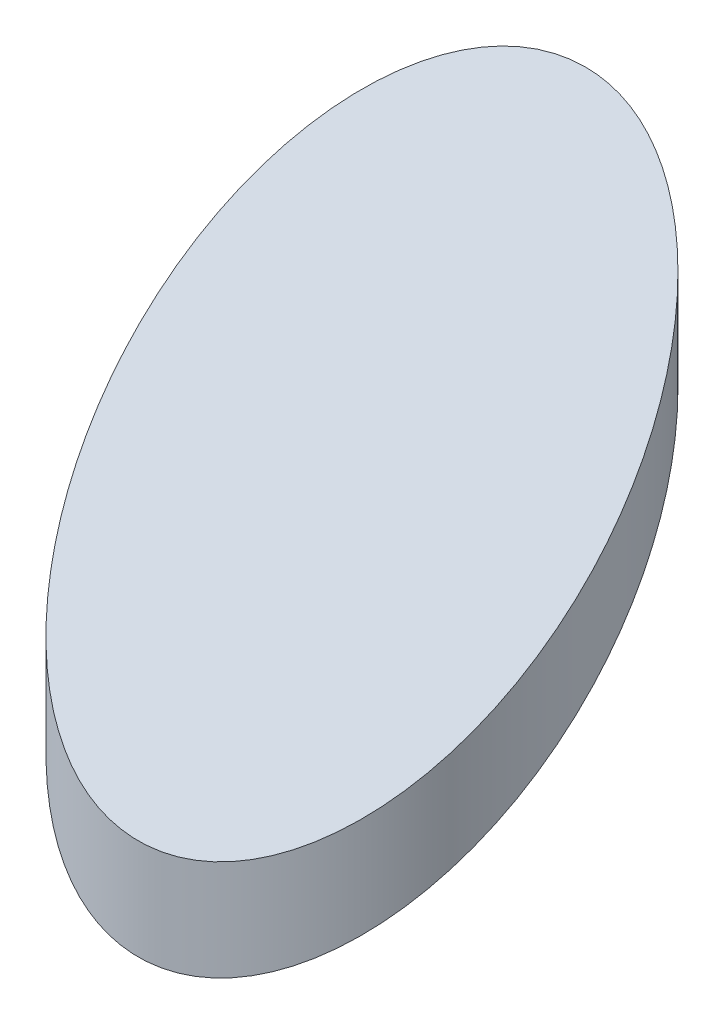
from build123d import *

# Parameters (mm, degrees)
SKETCH2_R               = 20
BOSS_EXTRUDE1_DEPTH     = 2
CUT_EXTRUDE2_DEPTH      = 46.628938186
CUT_EXTRUDE2_DEPTH_BACK = 46.628938186
SKETCH6_R               = 25.059608459
SKETCH6_R_2             = 6.28
SKETCH3_R               = 7.4
SKETCH3_R_2             = 5.9
BOSS_EXTRUDE2_DEPTH     = 1
SKETCH7_R               = 13.022061682
CUT_EXTRUDE3_DEPTH      = 1


with BuildPart() as part:
    # Sketch2 → Boss-Extrude1 (new body)
    with BuildSketch(Plane(origin=(0, 0, 0), x_dir=(1, 0, 0), z_dir=(0, 0.7071067811865464, 0.7071067811865488))):
        with Locations(Location((0, 20, 0), (0, 0, 270))):
            Circle(SKETCH2_R)
    extrude(amount=-BOSS_EXTRUDE1_DEPTH)

    # Sketch6 → Cut-Extrude2 (cut, two sides: drawn at the far end of the back side and taken through both)
    with BuildSketch(Plane(origin=(0, 0, 0), x_dir=(1, 0, 0), z_dir=(0, 1, 0)).offset(-CUT_EXTRUDE2_DEPTH_BACK)):
        with Locations((0, 9)):
            Circle(SKETCH6_R)
        with Locations(Location((0, 9, 0), (0, 0, 90))):
            Circle(SKETCH6_R_2, mode=Mode.SUBTRACT)
    extrude(amount=CUT_EXTRUDE2_DEPTH + CUT_EXTRUDE2_DEPTH_BACK, mode=Mode.SUBTRACT)


with BuildPart() as body_2:
    # Sketch3 → Boss-Extrude2 (new body)
    with BuildSketch(Plane(origin=(0, -3.25, 0), x_dir=(1, 0, 0), z_dir=(0, 1, 0))):
        with Locations(Location((0, 7.4, 0), (0, 0, 270))):
            Circle(SKETCH3_R)
        with Locations(Location((0, 7.4, 0), (0, 0, 270))):
            Circle(SKETCH3_R_2, mode=Mode.SUBTRACT)
    extrude(amount=BOSS_EXTRUDE2_DEPTH)

    # Sketch7 → Cut-Extrude3 (cut)
    with BuildSketch(Plane.XZ.offset(3.25)):
        with Locations((0.290894274, -7.517427113)):
            Circle(SKETCH7_R)
    extrude(amount=-CUT_EXTRUDE3_DEPTH, mode=Mode.SUBTRACT)


solid = part.part
